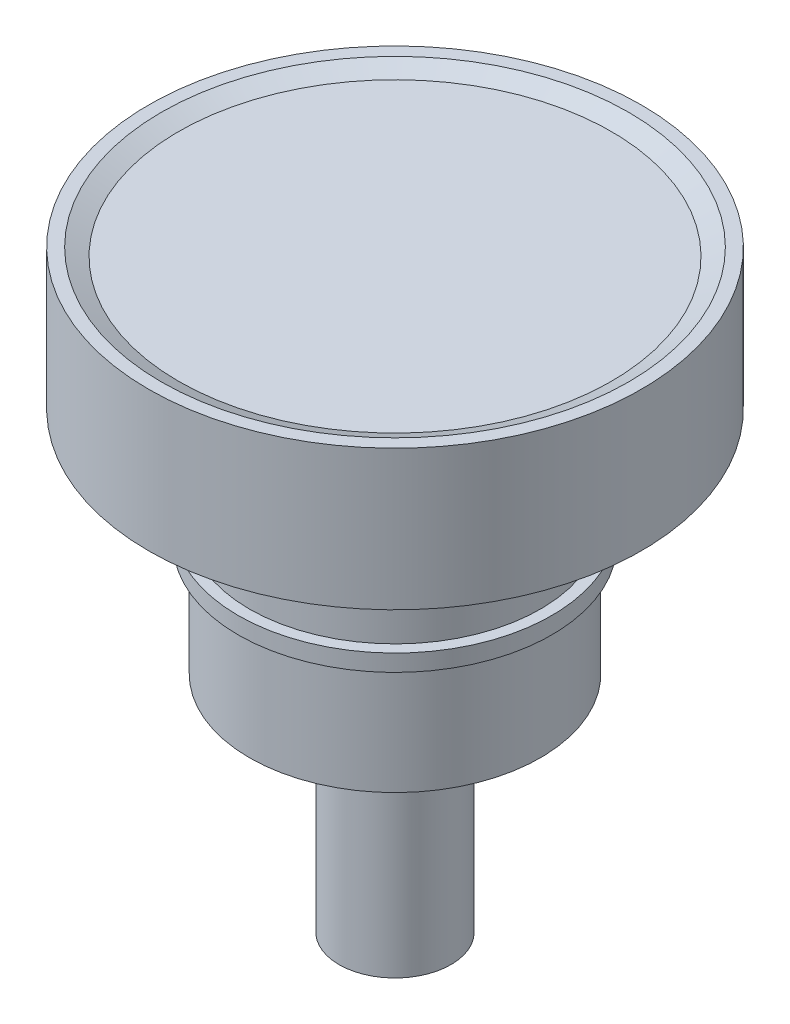
from build123d import *


with BuildPart() as part:
    # Sketch1 → Revolve1 (revolve)
    with BuildSketch(Plane.XY, mode=Mode.PRIVATE) as revolve1_sk:
        Polygon((0, 0), (5, 0), (5, 20), (13, 20), (13, 30), (14, 30), (14, 31.5), (13, 31.5), (13, 40.5), (22, 40.5), (22, 53), (20.864008208, 53), (19.325830603, 52.279251895), (0, 52.279251895), align=None)
    revolve(revolve1_sk.sketch.rotate(Axis((0, 52.279251895, 0), (0, -1, 0)), 90), axis=Axis((0, 52.279251895, 0), (0, -1, 0)))


solid = part.part
